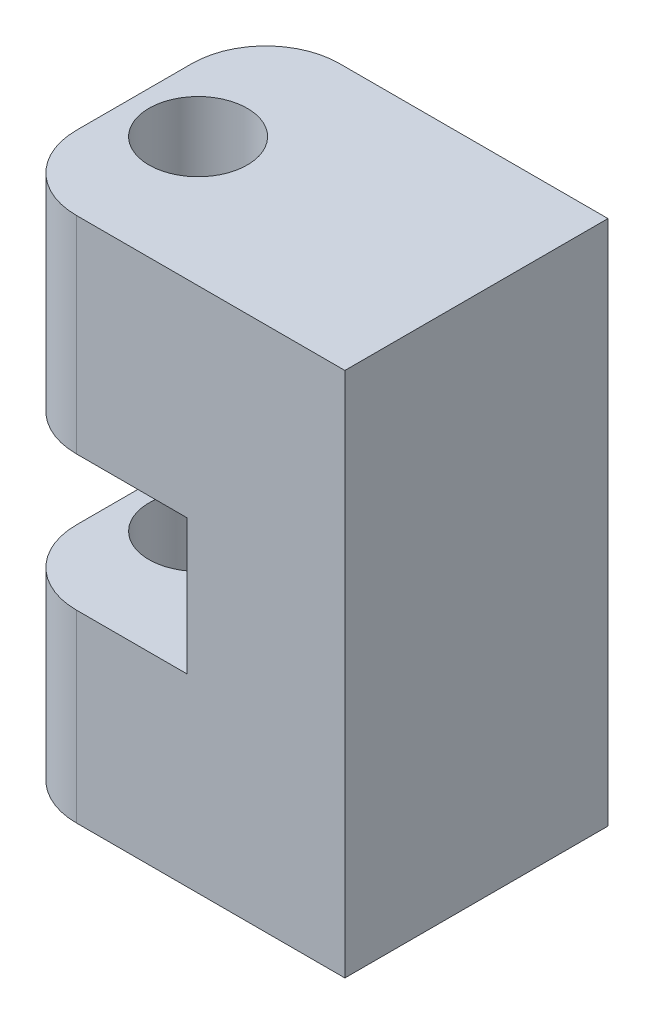
from build123d import *

# Parameters (mm, degrees)
BOSS_EXTRUDE4_DEPTH = 25.4
SKETCH3_R           = 2
CUT_EXTRUDE1_DEPTH  = 25.4
SKETCH5_W           = 54.299093249
SKETCH5_H           = 94.215662961
CUT_EXTRUDE2_DEPTH  = 4.5
SKETCH7_W           = 18.693193774
SKETCH7_H           = 5.5
CUT_EXTRUDE3_DEPTH  = 14.5
SKETCH9_W           = 36.111652001
SKETCH9_H           = 33.164105193
CUT_EXTRUDE4_DEPTH  = 1
SKETCH10_W          = 62.791660767
SKETCH10_H          = 37.243179947
CUT_EXTRUDE6_DEPTH  = 1
FILLET2_R           = 3
SKETCH11_W          = 10.7
SKETCH11_H          = 5.5
BOSS_EXTRUDE5_DEPTH = 2
SKETCH12_W          = 13.41826103
SKETCH12_H          = 56.552103836
CUT_EXTRUDE7_DEPTH  = 10
SKETCH14_W          = 10.7
SKETCH14_H          = 5.5
BOSS_EXTRUDE7_DEPTH = 2
SKETCH15_W          = 10.7
SKETCH15_H          = 9.5
BOSS_EXTRUDE8_DEPTH = 6
SKETCH16_W          = 10.7
SKETCH16_H          = 10.4
BOSS_EXTRUDE9_DEPTH = 6
FILLET3_R           = 3
SKETCH18_W          = 10.7
SKETCH18_H          = 5.5
CUT_EXTRUDE8_DEPTH  = 1
SKETCH21_W          = 35.797160714
SKETCH21_H          = 35.29022369
CUT_EXTRUDE9_DEPTH  = 3
SKETCH22_W          = 25.937316652
SKETCH22_H          = 36.458252548
CUT_EXTRUDE10_DEPTH = 2
SKETCH23_W          = 31.218703754
SKETCH23_H          = 37.872657663
CUT_EXTRUDE11_DEPTH = 2
SKETCH24_R          = 2
CUT_EXTRUDE12_DEPTH = 24


with BuildPart() as part:
    # Sketch1 → Boss-Extrude4 (new body)
    with BuildSketch(Plane(origin=(0, 0, 0), x_dir=(1, 0, 0), z_dir=(0, 1, 0))):
        with BuildLine():
            Line((0.717280831, 0), (0, 0))
            Line((0, 0), (0, 9.078373892))
            ThreePointArc((0, 9.078373892), (-0.063231401, 9.104565196), (-0.089422705, 9.167796597))
            Line((-0.089422705, 9.167796597), (-0.089422705, 9.317189397))
            ThreePointArc((-0.089422705, 9.317189397), (-0.063231401, 9.380420798), (0, 9.406612102))
            Line((0, 9.406612102), (0, 12.7))
            Line((0, 12.7), (0.98359831, 12.7))
            ThreePointArc((0.98359831, 12.7), (-3.239897706, 11.634417694), (-5.100024486, 7.695723417))
            Line((-5.100024486, 7.695723417), (-5.100024486, 5.049332428))
            ThreePointArc((-5.100024486, 5.049332428), (-3.343059972, 1.197813276), (0.717280831, 0))
        make_face()
        with BuildLine():
            Line((0, 9.078373892), (0, 0))
            Line((0, 0), (0.717280831, 0))
            ThreePointArc((0.717280831, 0), (3.851519152, 1.706272455), (5.100024486, 5.049332428))
            Line((5.100024486, 5.049332428), (5.100024486, 7.695723417))
            ThreePointArc((5.100024486, 7.695723417), (3.938694277, 10.935621123), (0.98359831, 12.7))
            Line((0.98359831, 12.7), (0, 12.7))
            Line((0, 12.7), (0, 9.406612102))
            ThreePointArc((0, 9.406612102), (0.063231401, 9.380420798), (0.089422705, 9.317189397))
            Line((0.089422705, 9.317189397), (0.089422705, 9.167796597))
            ThreePointArc((0.089422705, 9.167796597), (0.063231401, 9.104565196), (0, 9.078373892))
        make_face()
        with BuildLine():
            ThreePointArc((5.100024486, 5.049332428), (3.851519152, 1.706272455), (0.717280831, 0))
            Line((0.717280831, 0), (20.32, 0))
            Line((20.32, 0), (20.32, 12.7))
            Line((20.32, 12.7), (0.98359831, 12.7))
            ThreePointArc((0.98359831, 12.7), (3.938694277, 10.935621123), (5.100024486, 7.695723417))
            Line((5.100024486, 7.695723417), (5.100024486, 5.049332428))
        make_face()
    extrude(amount=BOSS_EXTRUDE4_DEPTH)

    # Sketch3 → Cut-Extrude1 (cut)
    with BuildSketch(Plane(origin=(0, 25.4, 0), x_dir=(1, 0, 0), z_dir=(0, 1, 0))):
        with Locations(Location((0, 6.163356084, 0), (0, 0, 270))):
            Circle(SKETCH3_R)
    extrude(amount=-CUT_EXTRUDE1_DEPTH, mode=Mode.SUBTRACT)

    # Sketch5 → Cut-Extrude2 (cut)
    with BuildSketch(Plane(origin=(20.32, 0, 0), x_dir=(0, 0, -1), z_dir=(1, 0, 0))):
        with Locations((11.125522758, -8.280714776)):
            Rectangle(SKETCH5_W, SKETCH5_H)
    extrude(amount=-CUT_EXTRUDE2_DEPTH, mode=Mode.SUBTRACT)

    # Sketch7 → Cut-Extrude3 (cut)
    with BuildSketch(Plane.ZY.offset(5.100024486)):
        with Locations((-6.318501351, 12.25)):
            Rectangle(SKETCH7_W, SKETCH7_H)
    extrude(amount=-CUT_EXTRUDE3_DEPTH, mode=Mode.SUBTRACT)

    # Sketch9 → Cut-Extrude4 (cut)
    with BuildSketch(Plane(origin=(0, 0, -12.7), x_dir=(-1, 0, 0), z_dir=(0, 0, -1))):
        with Locations((-4.511590843, 12.177462725)):
            Rectangle(SKETCH9_W, SKETCH9_H)
    extrude(amount=-CUT_EXTRUDE4_DEPTH, mode=Mode.SUBTRACT)


with BuildPart() as body_2:
    # of the pieces the cut leaves, the one that is kept (cut_extrude4_keep)
    add(part.part.solids().sort_by_distance((-0.089422705, 0, -9.167796597))[0])

    # Sketch10 → Cut-Extrude6 (cut)
    with BuildSketch(Plane.XY):
        with Locations((3.132657463, 10.976513171)):
            Rectangle(SKETCH10_W, SKETCH10_H)
    extrude(amount=-CUT_EXTRUDE6_DEPTH, mode=Mode.SUBTRACT)


with BuildPart() as body_2_2:
    # of the pieces the cut leaves, the one that is kept (cut_extrude6_keep)
    add(body_2.part.solids().sort_by_distance((-0.089422705, 0, -9.167796597))[0])

    # Fillet2
    fillet2_edges = [body_2_2.edges().sort_by_distance(p)[0] for p in [
        (-3.100509095, 20.2, -1),
        (-3.100509095, 4.75, -1),
        (-3.158483624, 4.75, -11.7),
        (-3.158483624, 20.2, -11.7),
    ]]
    fillet(fillet2_edges, radius=FILLET2_R)

    # Sketch11 → Boss-Extrude5 (add)
    with BuildSketch(Plane.ZY.offset(-9.399975514)):
        with Locations((-6.35, 12.25)):
            Rectangle(SKETCH11_W, SKETCH11_H)
    extrude(amount=BOSS_EXTRUDE5_DEPTH)

    # Sketch12 → Cut-Extrude7 (cut)
    with BuildSketch(Plane.ZY.offset(5.100024486)):
        with Locations((-6.709130515, 16.674143704)):
            Rectangle(SKETCH12_W, SKETCH12_H)
    extrude(amount=-CUT_EXTRUDE7_DEPTH, mode=Mode.SUBTRACT)

    # Sketch14 → Boss-Extrude7 (add)
    with BuildSketch(Plane.ZY.offset(-7.399975514)):
        with Locations((-6.35, 12.25)):
            Rectangle(SKETCH14_W, SKETCH14_H)
    extrude(amount=BOSS_EXTRUDE7_DEPTH)

    # Sketch15 → Boss-Extrude8 (add)
    with BuildSketch(Plane.ZY.offset(-4.899975514)):
        with Locations((-6.35, 4.75)):
            Rectangle(SKETCH15_W, SKETCH15_H)
    extrude(amount=BOSS_EXTRUDE8_DEPTH)

    # Sketch16 → Boss-Extrude9 (add)
    with BuildSketch(Plane.ZY.offset(-4.899975514)):
        with Locations((-6.35, 20.2)):
            Rectangle(SKETCH16_W, SKETCH16_H)
    extrude(amount=BOSS_EXTRUDE9_DEPTH)

    # Fillet3
    fillet3_edges = [body_2_2.edges().sort_by_distance(p)[0] for p in [
        (-1.100024486, 4.75, -11.7),
        (-1.100024486, 4.75, -1),
        (-1.100024486, 20.2, -11.7),
        (-1.100024486, 20.2, -1),
    ]]
    fillet(fillet3_edges, radius=FILLET3_R)

    # Sketch18 → Cut-Extrude8 (cut)
    with BuildSketch(Plane.ZY.offset(-5.399975514)):
        with Locations((-6.35, 12.25)):
            Rectangle(SKETCH18_W, SKETCH18_H)
    extrude(amount=-CUT_EXTRUDE8_DEPTH, mode=Mode.SUBTRACT)

    # Sketch21 → Cut-Extrude9 (cut)
    with BuildSketch(Plane(origin=(15.82, 0, 0), x_dir=(0, 0, -1), z_dir=(1, 0, 0))):
        with Locations((4.247356295, 13.050264646)):
            Rectangle(SKETCH21_W, SKETCH21_H)
    extrude(amount=-CUT_EXTRUDE9_DEPTH, mode=Mode.SUBTRACT)

    # Sketch22 → Cut-Extrude10 (cut)
    with BuildSketch(Plane(origin=(0, 25.4, 0), x_dir=(1, 0, 0), z_dir=(0, 1, 0))):
        with Locations((4.63538262, 4.299284276)):
            Rectangle(SKETCH22_W, SKETCH22_H)
    extrude(amount=-CUT_EXTRUDE10_DEPTH, mode=Mode.SUBTRACT)

    # Sketch23 → Cut-Extrude11 (cut)
    with BuildSketch(Plane.XZ):
        with Locations((9.360738883, -6.802201309)):
            Rectangle(SKETCH23_W, SKETCH23_H)
    extrude(amount=-CUT_EXTRUDE11_DEPTH, mode=Mode.SUBTRACT)

    # Sketch24 → Cut-Extrude12 (cut)
    with BuildSketch(Plane.XZ.offset(-2)):
        with Locations(Location((1.599975514, -6.25, 0), (0, 0, 270))):
            Circle(SKETCH24_R)
    extrude(amount=-CUT_EXTRUDE12_DEPTH, mode=Mode.SUBTRACT)


solid = body_2_2.part
